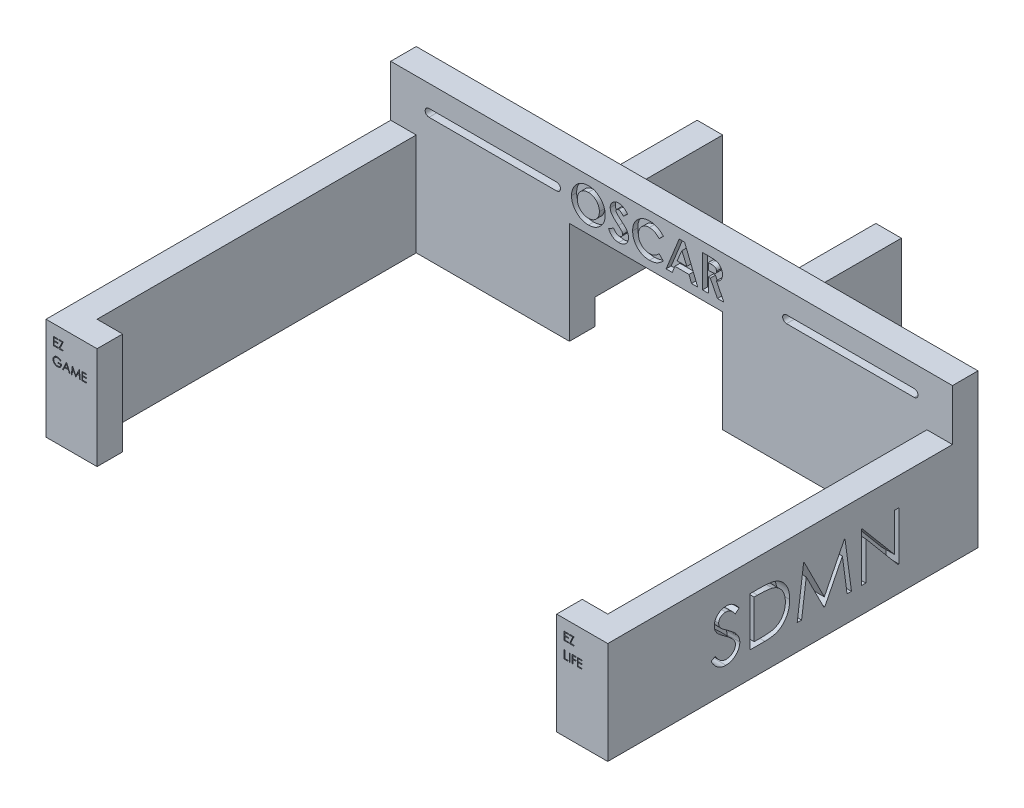
from build123d import *

# Parameters (mm, degrees)
SKETCH2_W           = 70
SKETCH2_H           = 40
BOSS_EXTRUDE1_DEPTH = 10
SKETCH3_W           = 10
SKETCH3_H           = 40
BOSS_EXTRUDE2_DEPTH = 135
SKETCH4_W           = 10
SKETCH4_H           = 40
BOSS_EXTRUDE3_DEPTH = 10
SKETCH5_W           = 10
SKETCH5_H           = 30
BOSS_EXTRUDE4_DEPTH = 50
SKETCH6_W           = 2
SKETCH6_H           = 23
SKETCH6_H_2         = 2
SKETCH6_W_2         = 13
SKETCH6_R           = 12.5
SKETCH6_R_2         = 10.5
CUT_EXTRUDE1_DEPTH  = 5
CUT_EXTRUDE2_DEPTH  = 2
CUT_EXTRUDE3_DEPTH  = 5
SKETCH10_W          = 0.284935898
SKETCH10_H          = 3.175
CUT_EXTRUDE4_DEPTH  = 1


with BuildPart() as part:
    # Sketch2 → Boss-Extrude1 (new body)
    # profile 1 of 3: a face of its own
    with BuildSketch(Plane.XY):
        Polygon((-110, 36.756781578), (-110, 16.756781578), (-40, 16.756781578), (20, 16.756781578), (40, 16.756781578), (110, 16.756781578), (110, 36.756781578), align=None)
        with BuildLine():
            Line((-45, 25.256781578), (-95, 25.256781578))
            ThreePointArc((-95, 25.256781578), (-96.5, 26.756781578), (-95, 28.256781578))
            Line((-95, 28.256781578), (-45, 28.256781578))
            ThreePointArc((-45, 28.256781578), (-43.939339828, 27.81744175), (-43.5, 26.756781578))
            ThreePointArc((-43.5, 26.756781578), (-43.939339828, 25.696121407), (-45, 25.256781578))
        make_face(mode=Mode.SUBTRACT)
        with BuildLine():
            ThreePointArc((45, 25.256781578), (43.5, 26.756781578), (45, 28.256781578))
            Line((45, 28.256781578), (95, 28.256781578))
            ThreePointArc((95, 28.256781578), (96.060660172, 27.81744175), (96.5, 26.756781578))
            ThreePointArc((96.5, 26.756781578), (96.060660172, 25.696121407), (95, 25.256781578))
            Line((95, 25.256781578), (45, 25.256781578))
        make_face(mode=Mode.SUBTRACT)
    # profile 2 of 3: a face of its own
    with BuildSketch(Plane.XY):
        with Locations((-75, -3.243218422)):
            Rectangle(SKETCH2_W, SKETCH2_H)
    # profile 3 of 3: a face of its own
    with BuildSketch(Plane.XY):
        Polygon((40, 16.756781578), (20, 16.756781578), (20, -23.243218422), (110, -23.243218422), (110, 16.756781578), align=None)
    extrude(amount=BOSS_EXTRUDE1_DEPTH)

    # Sketch3 → Boss-Extrude2 (add)
    with BuildSketch(Plane.XY.offset(10)):
        with Locations((-105, -3.243218422)):
            Rectangle(SKETCH3_W, SKETCH3_H)
        with Locations((105, -3.243218422)):
            Rectangle(SKETCH3_W, SKETCH3_H)
    extrude(amount=BOSS_EXTRUDE2_DEPTH)

    # Sketch4 → Boss-Extrude3 (add)
    with BuildSketch(Plane(origin=(-100, 0, 0), x_dir=(0, 0, -1), z_dir=(1, 0, 0))):
        with Locations((-140, -3.243218422)):
            Rectangle(SKETCH4_W, SKETCH4_H)
    boss_extrude3 = extrude(amount=BOSS_EXTRUDE3_DEPTH)

    # Mirror1: Boss-Extrude3 across plane
    add(boss_extrude3.mirror(Plane(origin=(0, 0, 0), x_dir=(0, 0, 1), z_dir=(1, 0, 0))))

    # Sketch5 → Boss-Extrude4 (add)
    with BuildSketch(Plane(origin=(0, 0, 0), x_dir=(-1, 0, 0), z_dir=(0, 0, -1))):
        with Locations((-25, 1.756781578)):
            Rectangle(SKETCH5_W, SKETCH5_H)
        with Locations((45, 1.756781578)):
            Rectangle(SKETCH5_W, SKETCH5_H)
    extrude(amount=BOSS_EXTRUDE4_DEPTH)

    # Sketch6 → Cut-Extrude1 (cut)
    # profile 1 of 7: a face of its own
    with BuildSketch(Plane.ZY.offset(110)):
        Polygon((28.898499969, 9.256781578), (28.898499969, -15.743218422), (30.898499969, -15.743218422), (30.898499969, 6.256781578), (30.898499969, 9.256781578), align=None)
    # profile 2 of 7: a face of its own
    with BuildSketch(Plane.ZY.offset(110)):
        Polygon((30.898499969, 9.256781578), (30.898499969, 6.256781578), (45.898499969, -15.743218422), (45.898499969, -12.743218422), align=None)
    # profile 3 of 7: a face of its own
    with BuildSketch(Plane.ZY.offset(110)):
        Polygon((45.898499969, -12.743218422), (45.898499969, -15.743218422), (47.898499969, -15.743218422), (47.898499969, 9.256781578), (45.898499969, 9.256781578), align=None)
    # profile 4 of 7: a face of its own
    with BuildSketch(Plane.ZY.offset(110)):
        with Locations((93.898499969, -2.243218422)):
            Rectangle(SKETCH6_W, SKETCH6_H)
    # profile 5 of 7: a face of its own
    with BuildSketch(Plane.ZY.offset(110)):
        with Locations((93.898499969, -14.743218422)):
            Rectangle(SKETCH6_W, SKETCH6_H_2)
    # profile 6 of 7: a face of its own
    with BuildSketch(Plane.ZY.offset(110)):
        with Locations((101.398499969, -14.743218422)):
            Rectangle(SKETCH6_W_2, SKETCH6_H_2)
    # profile 7 of 7: a face of its own
    with BuildSketch(Plane.ZY.offset(110)):
        with Locations(Location((65.398499969, -3.243218422, 0), (0, 0, 270))):
            Circle(SKETCH6_R)
        with Locations(Location((65.398499969, -3.243218422, 0), (0, 0, 270))):
            Circle(SKETCH6_R_2, mode=Mode.SUBTRACT)
    extrude(amount=-CUT_EXTRUDE1_DEPTH, mode=Mode.SUBTRACT)

    # Sketch8 → Cut-Extrude2 (cut)
    # profile 1 of 5: a face of its own
    with BuildSketch(Plane.XY.offset(10)):
        with BuildLine():
            add(Edge.make_bspline(
                [(-32.566225962, 33.282422604), (-32.345420897, 33.276705565), (-31.909501688, 33.265418836), (-31.268421838, 33.171335142), (-30.650622868, 33.018039249), (-30.056384144, 32.804946871), (-29.487193572, 32.526286382), (-28.941043425, 32.189957991), (-28.419889989, 31.7896137), (-27.929073624, 31.334592882), (-27.475470783, 30.83977761), (-27.082423656, 30.307020999), (-26.747247486, 29.750127307), (-26.469452579, 29.167604322), (-26.257860052, 28.555417794), (-26.109376823, 27.916689065), (-26.013983705, 27.251599848), (-26.003012029, 26.798764743), (-25.997435897, 26.568620521)],
                knots=[0, 0, 0, 0, 1.014329547, 2.002516266, 2.970391464, 3.935626869, 4.897733899, 5.877609409, 6.878433252, 7.912639331, 8.949961323, 9.958554974, 10.949718813, 11.932905612, 12.9188844, 13.919928257, 14.942845884, 16, 16, 16, 16], degree=3))
            add(Edge.make_bspline(
                [(-25.997435897, 26.568620521), (-26.003374236, 26.341069492), (-26.015075922, 25.892672889), (-26.105482458, 25.23371273), (-26.256466163, 24.601826117), (-26.464469915, 23.995582759), (-26.737226673, 23.41791909), (-27.065866543, 22.86514681), (-27.459061707, 22.342395776), (-27.902470794, 21.849946517), (-28.390625717, 21.402943146), (-28.907659275, 21.009022198), (-29.451184125, 20.675228452), (-30.020404721, 20.401714802), (-30.616541729, 20.189450931), (-31.238122617, 20.039683346), (-31.885108923, 19.94866656), (-32.325090986, 19.937041308), (-32.548417468, 19.931140553)],
                knots=[0, 0, 0, 0, 1.051557043, 2.072126891, 3.067553643, 4.050577992, 5.02905126, 6.015227836, 7.017913613, 8.04756643, 9.074058332, 10.072836633, 11.047628519, 12.017157415, 12.98668631, 13.966869689, 14.968021931, 16, 16, 16, 16], degree=3))
            add(Edge.make_bspline(
                [(-32.548417468, 19.931140553), (-32.78199019, 19.936433821), (-33.240928663, 19.946834371), (-33.912587172, 20.045738848), (-34.55609406, 20.19472354), (-35.166043499, 20.417075201), (-35.748647301, 20.695033473), (-36.299624907, 21.037355751), (-36.81879115, 21.443476319), (-37.30316801, 21.90299428), (-37.742014617, 22.405807717), (-38.129382828, 22.936985523), (-38.456136507, 23.492469969), (-38.72228761, 24.072521032), (-38.932110448, 24.673533836), (-39.080116619, 25.299168722), (-39.167547397, 25.947925192), (-39.179725997, 26.388573555), (-39.185897436, 26.611869719)],
                knots=[0, 0, 0, 0, 1.067978421, 2.098431617, 3.099715153, 4.085208694, 5.062210972, 6.048429807, 7.046490867, 8.072918869, 9.098532598, 10.095778865, 11.076610158, 12.041847152, 13.011192615, 13.984257998, 14.978533688, 16, 16, 16, 16], degree=3))
            add(Edge.make_bspline(
                [(-39.185897436, 26.611869719), (-39.183960483, 26.762091689), (-39.180111103, 27.060633475), (-39.133741265, 27.503057161), (-39.066982031, 27.936845331), (-38.968248291, 28.360268466), (-38.848312033, 28.776313617), (-38.692917667, 29.181108134), (-38.516036826, 29.578976336), (-38.309368218, 29.965218901), (-38.079572708, 30.336282074), (-37.828845347, 30.690415486), (-37.556555686, 31.023337147), (-37.263580858, 31.337234879), (-36.948911233, 31.630045411), (-36.616685965, 31.905913883), (-36.260461818, 32.157512248), (-35.888035422, 32.39098504), (-35.501506429, 32.602110437), (-35.102448365, 32.78181406), (-34.699082613, 32.938746173), (-34.286020752, 33.062603936), (-33.867689473, 33.163484788), (-33.439619754, 33.230199027), (-33.005678962, 33.27656758), (-32.713057932, 33.280466298), (-32.566225962, 33.282422604)],
                knots=[0, 0, 0, 0, 1.034744296, 2.056386356, 3.06226378, 4.057406941, 5.050368692, 6.043467995, 7.042652155, 8.049140477, 9.059438543, 10.048523776, 11.036952808, 12.020949711, 13.004946614, 13.997082645, 14.994316842, 16.007702937, 17.024872941, 18.026463647, 19.021641123, 20.005082605, 20.995858141, 21.984425357, 22.988620895, 24, 24, 24, 24], degree=3))
        make_face()
        with BuildLine():
            add(Edge.make_bspline(
                [(-32.601842949, 31.002935424), (-32.750444728, 30.998948105), (-33.043725175, 30.991078732), (-33.47391418, 30.931124754), (-33.886910817, 30.835371437), (-34.280425683, 30.696673927), (-34.656164304, 30.520147198), (-35.01479275, 30.306408056), (-35.351344756, 30.048109458), (-35.670307921, 29.759118303), (-35.958438653, 29.437115742), (-36.213011245, 29.092035235), (-36.426047502, 28.724453062), (-36.604466701, 28.337783973), (-36.738776814, 27.927679978), (-36.834441881, 27.497353465), (-36.894898633, 27.046062961), (-36.902519281, 26.738418811), (-36.906410256, 26.581340873)],
                knots=[0, 0, 0, 0, 1.033739768, 2.040188636, 3.016340934, 3.979330865, 4.937572243, 5.900995986, 6.878200029, 7.884839167, 8.891893314, 9.879764717, 10.863503415, 11.843163062, 12.837761627, 13.859916423, 14.907309254, 16, 16, 16, 16], degree=3))
            add(Edge.make_bspline(
                [(-36.906410256, 26.581340873), (-36.901251417, 26.407263184), (-36.891140947, 26.066099756), (-36.820002451, 25.568419739), (-36.698291566, 25.098410358), (-36.522543413, 24.658370358), (-36.304569596, 24.243413424), (-36.03388071, 23.858625445), (-35.714860634, 23.501702488), (-35.469090151, 23.293315999), (-35.344350962, 23.187550809)],
                knots=[0, 0, 0, 0, 1.078454662, 2.113592447, 3.107694534, 4.079536787, 5.043276885, 6.005368276, 6.987637804, 8, 8, 8, 8], degree=3))
            add(Edge.make_bspline(
                [(-35.344350962, 23.187550809), (-35.242165751, 23.109415549), (-35.04009758, 22.954905429), (-34.717552785, 22.756869013), (-34.385395158, 22.58713205), (-34.041118154, 22.449986591), (-33.685448868, 22.342110279), (-33.318436072, 22.266566271), (-32.940599794, 22.219155873), (-32.685089195, 22.213489432), (-32.556049679, 22.210627732)],
                knots=[0, 0, 0, 0, 1.023928204, 2.024787132, 3.009472467, 3.9914905, 4.972207045, 5.96565515, 6.972602802, 8, 8, 8, 8], degree=3))
            add(Edge.make_bspline(
                [(-32.556049679, 22.210627732), (-32.410003111, 22.21464886), (-32.122651896, 22.222560554), (-31.700471091, 22.281776466), (-31.296009058, 22.381991168), (-30.906754861, 22.519471974), (-30.533830936, 22.698215149), (-30.179059864, 22.918583808), (-29.841819634, 23.177872109), (-29.523262824, 23.470658351), (-29.232086842, 23.79392938), (-28.97804549, 24.14085051), (-28.758235746, 24.503778031), (-28.583526777, 24.887848632), (-28.443910374, 25.289436866), (-28.349396686, 25.71032128), (-28.288429212, 26.14876683), (-28.280806416, 26.447144521), (-28.276923077, 26.599149367)],
                knots=[0, 0, 0, 0, 1.026359118, 2.019393844, 2.989460624, 3.950973911, 4.916101784, 5.890408035, 6.881132271, 7.902007068, 8.92769091, 9.933912415, 10.920395702, 11.90457117, 12.894218921, 13.903490204, 14.931958862, 16, 16, 16, 16], degree=3))
            add(Edge.make_bspline(
                [(-28.276923077, 26.599149367), (-28.280940781, 26.750280143), (-28.288849017, 27.047758027), (-28.348169153, 27.485076336), (-28.447748319, 27.904102669), (-28.585641966, 28.30552134), (-28.761724851, 28.689725889), (-28.979469201, 29.055365225), (-29.238110979, 29.402085864), (-29.53169756, 29.727525038), (-29.85124851, 30.026582792), (-30.194318383, 30.28611056), (-30.5513077, 30.511631938), (-30.930407537, 30.68829628), (-31.32386183, 30.829044386), (-31.734071457, 30.932693311), (-32.162590112, 30.990657553), (-32.454120214, 30.99880632), (-32.601842949, 31.002935424)],
                knots=[0, 0, 0, 0, 1.055025985, 2.07665775, 3.074803781, 4.057872707, 5.035505728, 6.020516407, 7.023567878, 8.050795229, 9.077271434, 10.074415901, 11.050397877, 12.019801805, 12.988065821, 13.964604439, 14.968634123, 16, 16, 16, 16], degree=3))
        make_face(mode=Mode.SUBTRACT)
    # profile 2 of 5: a face of its own
    with BuildSketch(Plane.XY.offset(10)):
        with BuildLine():
            Line((-17.205128205, 31.259886546), (-18.909655449, 29.700371322))
            add(Edge.make_bspline(
                [(-18.909655449, 29.700371322), (-18.982670087, 29.80336606), (-19.12284801, 30.001101594), (-19.350061803, 30.265874134), (-19.576249609, 30.491744815), (-19.80350692, 30.677770053), (-20.03384806, 30.822819607), (-20.266873189, 30.925516294), (-20.501261223, 30.990801552), (-20.6587338, 30.998931137), (-20.736298077, 31.002935424)],
                knots=[0, 0, 0, 0, 1.299362458, 2.494594718, 3.587462134, 4.587049575, 5.512617175, 6.380583204, 7.202344345, 8, 8, 8, 8], degree=3))
            add(Edge.make_bspline(
                [(-20.736298077, 31.002935424), (-20.808647809, 31.000398124), (-20.948336134, 30.995499265), (-21.147472203, 30.946804965), (-21.324268042, 30.862765755), (-21.478551105, 30.752877417), (-21.600766053, 30.620487446), (-21.698345212, 30.481644407), (-21.753290477, 30.328393092), (-21.760522355, 30.223133907), (-21.764102564, 30.171024367)],
                knots=[0, 0, 0, 0, 1.185010067, 2.2879431, 3.333075148, 4.379039566, 5.372662701, 6.27520591, 7.14612461, 8, 8, 8, 8], degree=3))
            add(Edge.make_bspline(
                [(-21.764102564, 30.171024367), (-21.761859029, 30.118163383), (-21.757340861, 30.011708709), (-21.713701506, 29.855686126), (-21.647924537, 29.703233899), (-21.585071959, 29.610428975), (-21.552944712, 29.562991514)],
                knots=[0, 0, 0, 0, 0.967525499, 1.948461899, 2.951351359, 4, 4, 4, 4], degree=3))
            add(Edge.make_bspline(
                [(-21.552944712, 29.562991514), (-21.523737569, 29.526118872), (-21.456506583, 29.441242921), (-21.328310863, 29.306812644), (-21.167323962, 29.142123787), (-20.967350765, 28.952839519), (-20.73669271, 28.732152436), (-20.464658497, 28.488737832), (-20.159078458, 28.215057439), (-19.941879246, 28.024476323), (-19.828064904, 27.924610104)],
                knots=[0, 0, 0, 0, 0.473873513, 1.090794244, 1.870441696, 2.795289791, 3.865433203, 5.087734844, 6.473946851, 8, 8, 8, 8], degree=3))
            add(Edge.make_bspline(
                [(-19.828064904, 27.924610104), (-19.721233772, 27.832153148), (-19.518490479, 27.656689054), (-19.230027034, 27.407645946), (-18.976515709, 27.183587934), (-18.754263423, 26.987877649), (-18.566639303, 26.818461643), (-18.412854576, 26.674530109), (-18.291031024, 26.55888513), (-18.221781468, 26.489035491), (-18.192227564, 26.459225489)],
                knots=[0, 0, 0, 0, 1.543621617, 2.929473131, 4.163658386, 5.240097082, 6.164993805, 6.925417477, 7.541396219, 8, 8, 8, 8], degree=3))
            add(Edge.make_bspline(
                [(-18.192227564, 26.459225489), (-18.080106215, 26.337886176), (-17.864569606, 26.104629404), (-17.584447996, 25.743154765), (-17.35389885, 25.390281812), (-17.175541659, 25.039370666), (-17.040839135, 24.68535838), (-16.945872071, 24.31956282), (-16.888995664, 23.938161652), (-16.882681055, 23.677901915), (-16.879487179, 23.546264751)],
                knots=[0, 0, 0, 0, 1.206664779, 2.319633467, 3.337109185, 4.282041471, 5.190008762, 6.099243693, 7.03861361, 8, 8, 8, 8], degree=3))
            add(Edge.make_bspline(
                [(-16.879487179, 23.546264751), (-16.881760498, 23.418000479), (-16.886220835, 23.166341204), (-16.9408514, 22.79807534), (-17.01875138, 22.445628926), (-17.139198415, 22.112837076), (-17.285998548, 21.794237113), (-17.470033717, 21.494791813), (-17.686157788, 21.211470666), (-17.933869157, 20.949338384), (-18.207867346, 20.711471507), (-18.501756444, 20.499716795), (-18.818410247, 20.324886307), (-19.155123314, 20.180925871), (-19.51171541, 20.070045619), (-19.887761728, 19.988094778), (-20.283837454, 19.938909175), (-20.554679743, 19.933767404), (-20.693048878, 19.931140553)],
                knots=[0, 0, 0, 0, 1.043214005, 2.046824704, 3.02475056, 3.976699089, 4.921714032, 5.875962561, 6.831408892, 7.817874052, 8.806269674, 9.781291748, 10.760897367, 11.74438705, 12.757449933, 13.795994037, 14.874007457, 16, 16, 16, 16], degree=3))
            add(Edge.make_bspline(
                [(-20.693048878, 19.931140553), (-20.801667471, 19.933067519), (-21.016794577, 19.936884017), (-21.333859407, 19.968042548), (-21.640021344, 20.018329102), (-21.934935521, 20.090404755), (-22.219930581, 20.181734383), (-22.495018227, 20.293290026), (-22.758299438, 20.426800753), (-23.011766324, 20.579521053), (-23.254186724, 20.756849439), (-23.488625948, 20.955160489), (-23.712755323, 21.177504316), (-23.927651297, 21.423355086), (-24.131938906, 21.693408988), (-24.332305216, 21.983905024), (-24.519845346, 22.300234403), (-24.635697226, 22.522142022), (-24.694871795, 22.635487508)],
                knots=[0, 0, 0, 0, 1.016823716, 2.013894106, 2.979844003, 3.91962641, 4.853723003, 5.779685073, 6.695824784, 7.614987388, 8.547259901, 9.504950863, 10.487499108, 11.500346958, 12.559593716, 13.656357062, 14.802919212, 16, 16, 16, 16], degree=3))
            Line((-24.694871795, 22.635487508), (-22.690144231, 23.83883286))
            add(Edge.make_bspline(
                [(-22.690144231, 23.83883286), (-22.616125689, 23.710170925), (-22.474225819, 23.463514997), (-22.233763224, 23.132101498), (-21.987421571, 22.848300694), (-21.729505662, 22.617128785), (-21.463151658, 22.435494703), (-21.187073007, 22.305686387), (-20.901075742, 22.225335186), (-20.706267398, 22.215522449), (-20.609094551, 22.210627732)],
                knots=[0, 0, 0, 0, 1.283663364, 2.460892379, 3.537111102, 4.529833553, 5.449777664, 6.316464042, 7.160231139, 8, 8, 8, 8], degree=3))
            add(Edge.make_bspline(
                [(-20.609094551, 22.210627732), (-20.510255854, 22.214625023), (-20.318494388, 22.22238035), (-20.044779432, 22.294013964), (-19.793827197, 22.406483992), (-19.576905939, 22.566963214), (-19.393230694, 22.752180627), (-19.25766782, 22.958243468), (-19.172506309, 23.181198488), (-19.163502672, 23.336077711), (-19.158974359, 23.413973085)],
                knots=[0, 0, 0, 0, 1.13588714, 2.203786484, 3.234766741, 4.283437687, 5.291419208, 6.222934724, 7.106237994, 8, 8, 8, 8], degree=3))
            add(Edge.make_bspline(
                [(-19.158974359, 23.413973085), (-19.163156071, 23.486442054), (-19.171650818, 23.633655829), (-19.23422051, 23.852539039), (-19.332036023, 24.071322705), (-19.447758672, 24.250774987), (-19.565520959, 24.401025519), (-19.678128266, 24.531210808), (-19.815254177, 24.67504276), (-19.976551003, 24.832702307), (-20.15988759, 25.005577364), (-20.365418377, 25.193651004), (-20.595496908, 25.395266521), (-20.758116867, 25.53260502), (-20.843149038, 25.604417796)],
                knots=[0, 0, 0, 0, 0.916159276, 1.861089862, 2.860218735, 3.940849679, 4.552606315, 5.27541173, 6.11797699, 7.06649574, 8.129236253, 9.306560635, 10.591630461, 12, 12, 12, 12], degree=3))
            add(Edge.make_bspline(
                [(-20.843149038, 25.604417796), (-21.004798581, 25.74118881), (-21.315052979, 26.003693782), (-21.753481808, 26.391405363), (-22.148545438, 26.753757361), (-22.496831678, 27.095229238), (-22.802778231, 27.409514802), (-23.064313095, 27.699166798), (-23.278563191, 27.966419497), (-23.504015219, 28.282962435), (-23.718239722, 28.668691755), (-23.903390484, 29.132768843), (-24.023508484, 29.596787046), (-24.036966035, 29.90830331), (-24.043589744, 30.061629335)],
                knots=[0, 0, 0, 0, 1.345494975, 2.582412109, 3.71882943, 4.751509156, 5.681369928, 6.505683931, 7.230279997, 7.856715994, 8.973648664, 10.023341002, 11.027102913, 12, 12, 12, 12], degree=3))
            add(Edge.make_bspline(
                [(-24.043589744, 30.061629335), (-24.040834952, 30.170359922), (-24.035407717, 30.384570858), (-23.986995944, 30.699536827), (-23.914642704, 31.003452524), (-23.809565028, 31.295209124), (-23.673186892, 31.574441191), (-23.507560943, 31.842515683), (-23.310115324, 32.096965303), (-23.087607441, 32.337621369), (-22.842460722, 32.557553627), (-22.5804903, 32.751665882), (-22.303178949, 32.915615915), (-22.012223121, 33.051624373), (-21.705819882, 33.155730207), (-21.386226493, 33.229525611), (-21.052984554, 33.273416764), (-20.82632058, 33.279383257), (-20.710857372, 33.282422604)],
                knots=[0, 0, 0, 0, 1.010766082, 1.991317756, 2.957454644, 3.913069143, 4.869106762, 5.843196583, 6.838735724, 7.860187025, 8.887984031, 9.89767229, 10.887916223, 11.879572884, 12.879850636, 13.892031539, 14.926195476, 16, 16, 16, 16], degree=3))
            add(Edge.make_bspline(
                [(-20.710857372, 33.282422604), (-20.561222769, 33.276948651), (-20.263134727, 33.266043956), (-19.822402959, 33.180772799), (-19.391914596, 33.046674923), (-19.045019004, 32.884900589), (-18.769000657, 32.728189715), (-18.557458378, 32.583910082), (-18.342202722, 32.418630009), (-18.121497787, 32.231828653), (-17.899444611, 32.019986433), (-17.669729161, 31.788146418), (-17.435481591, 31.534304969), (-17.283257812, 31.352961815), (-17.205128205, 31.259886546)],
                knots=[0, 0, 0, 0, 1.282922637, 2.555718331, 3.837320111, 5.142675274, 5.830281639, 6.55870424, 7.337177975, 8.157850921, 9.037902056, 9.96903443, 10.957596896, 12, 12, 12, 12], degree=3))
        make_face()
    # profile 3 of 5: a face of its own
    with BuildSketch(Plane.XY.offset(10)):
        with BuildLine():
            Line((-3.202564103, 30.753616514), (-4.874018429, 29.155940232))
            add(Edge.make_bspline(
                [(-4.874018429, 29.155940232), (-5.015804803, 29.302547579), (-5.292758009, 29.588917659), (-5.73903385, 29.968046408), (-6.203144476, 30.283998923), (-6.67606154, 30.550092118), (-7.16629145, 30.751410586), (-7.668165813, 30.898114744), (-8.184889244, 30.987554724), (-8.534587788, 30.99778824), (-8.710476763, 31.002935424)],
                knots=[0, 0, 0, 0, 1.115251505, 2.178435587, 3.19620269, 4.182487026, 5.141301733, 6.088180966, 7.038406374, 8, 8, 8, 8], degree=3))
            add(Edge.make_bspline(
                [(-8.710476763, 31.002935424), (-8.857365432, 30.998868969), (-9.147234036, 30.990844268), (-9.572837107, 30.932015291), (-9.97994844, 30.831974055), (-10.369961642, 30.694098702), (-10.741729082, 30.515695312), (-11.096030216, 30.296901965), (-11.431991531, 30.039694677), (-11.745175171, 29.745404249), (-12.031664558, 29.423869842), (-12.284796173, 29.080793397), (-12.496834506, 28.716960883), (-12.670850917, 28.336056927), (-12.806402974, 27.936318519), (-12.903204173, 27.518014777), (-12.9591914, 27.080647534), (-12.967547869, 26.783328542), (-12.971794872, 26.632222283)],
                knots=[0, 0, 0, 0, 1.035432265, 2.043311493, 3.022114605, 3.98653278, 4.95457646, 5.923598177, 6.917315552, 7.932509744, 8.948865224, 9.949768934, 10.933144597, 11.912367597, 12.897413939, 13.903909035, 14.934704909, 16, 16, 16, 16], degree=3))
            add(Edge.make_bspline(
                [(-12.971794872, 26.632222283), (-12.970570934, 26.526165339), (-12.968158527, 26.317124921), (-12.941750469, 26.007896127), (-12.899227268, 25.707871092), (-12.837685661, 25.417504273), (-12.760727277, 25.136544037), (-12.670437569, 24.862566552), (-12.557170458, 24.599357573), (-12.431442256, 24.343860096), (-12.285221806, 24.103045691), (-12.127569187, 23.87340917), (-11.956620661, 23.656076188), (-11.771268985, 23.451935209), (-11.568905564, 23.2641765), (-11.354760743, 23.087153933), (-11.125222197, 22.925298982), (-10.885058022, 22.774549719), (-10.632193504, 22.643592552), (-10.373489443, 22.524970658), (-10.105023364, 22.428632044), (-9.830064003, 22.350974332), (-9.549593967, 22.284938046), (-9.26087, 22.244277476), (-8.966394977, 22.213485701), (-8.767379288, 22.211584489), (-8.667227564, 22.210627732)],
                knots=[0, 0, 0, 0, 1.103660481, 2.175337485, 3.227646561, 4.255952547, 5.262355991, 6.258840057, 7.255597736, 8.242457506, 9.22035537, 10.185017736, 11.140346927, 12.096287581, 13.051739095, 14.01125915, 14.986044842, 15.97314143, 16.960198552, 17.947847494, 18.933482797, 19.925264591, 20.920966487, 21.929612487, 22.958107872, 24, 24, 24, 24], degree=3))
            add(Edge.make_bspline(
                [(-8.667227564, 22.210627732), (-8.497353028, 22.215541405), (-8.16359374, 22.225195495), (-7.673753993, 22.30068911), (-7.206985515, 22.424871835), (-6.834039734, 22.571524417), (-6.541846566, 22.716345746), (-6.319404227, 22.850298344), (-6.089381511, 23.000139031), (-5.855598899, 23.171522958), (-5.6154268, 23.36239345), (-5.373104806, 23.576930925), (-5.12242943, 23.808070972), (-4.958214477, 23.973040165), (-4.874018429, 24.057622924)],
                knots=[0, 0, 0, 0, 1.404581149, 2.759636711, 4.088442092, 5.392261763, 6.066678138, 6.783632037, 7.538459478, 8.336747902, 9.180226004, 10.074962426, 11.012997595, 12, 12, 12, 12], degree=3))
            Line((-4.874018429, 24.057622924), (-3.253445513, 22.355639751))
            add(Edge.make_bspline(
                [(-3.253445513, 22.355639751), (-3.367363066, 22.24565593), (-3.589705768, 22.030991032), (-3.925103561, 21.726186908), (-4.260079243, 21.452286518), (-4.586540498, 21.19934848), (-4.909835104, 20.974741493), (-5.229928775, 20.778241238), (-5.54319791, 20.60487794), (-5.856147644, 20.457575287), (-6.170725311, 20.332500035), (-6.494388763, 20.224818453), (-6.828127469, 20.133723709), (-7.173979752, 20.060222213), (-7.528719715, 20.001283937), (-7.89566725, 19.961500941), (-8.27249573, 19.934756157), (-8.528104326, 19.932352916), (-8.657051282, 19.931140553)],
                knots=[0, 0, 0, 0, 1.244526981, 2.429050516, 3.560637417, 4.644440555, 5.67424972, 6.652764056, 7.595344123, 8.486817594, 9.369275933, 10.254498637, 11.166417451, 12.086725134, 13.032340136, 13.991389299, 14.986715468, 16, 16, 16, 16], degree=3))
            add(Edge.make_bspline(
                [(-8.657051282, 19.931140553), (-8.893910868, 19.937178576), (-9.35737924, 19.948993309), (-10.036580054, 20.036532482), (-10.681802595, 20.183290363), (-11.294616569, 20.390846486), (-11.874827115, 20.655989705), (-12.422285798, 20.981042842), (-12.936110236, 21.365142282), (-13.41214974, 21.803786006), (-13.842750126, 22.288231175), (-14.223351002, 22.808392384), (-14.53818406, 23.366826034), (-14.799596733, 23.955282277), (-15.004018004, 24.576446467), (-15.147895925, 25.230990514), (-15.236624388, 25.918282416), (-15.246331408, 26.387718629), (-15.251282051, 26.627134142)],
                knots=[0, 0, 0, 0, 1.078019885, 2.10938526, 3.111377082, 4.085535484, 5.04941344, 6.010039228, 6.978205633, 7.964457913, 8.951525778, 9.924444315, 10.892603023, 11.863865945, 12.85144698, 13.863884204, 14.910567087, 16, 16, 16, 16], degree=3))
            add(Edge.make_bspline(
                [(-15.251282051, 26.627134142), (-15.249190149, 26.783278898), (-15.245044511, 27.09271964), (-15.20147347, 27.548550923), (-15.140732904, 27.992904888), (-15.04437352, 28.421167669), (-14.928221786, 28.839108755), (-14.783771845, 29.242185614), (-14.611254402, 29.631556731), (-14.416230102, 30.007873935), (-14.195601062, 30.368671946), (-13.949134204, 30.71085094), (-13.683174546, 31.037052476), (-13.39133151, 31.342948886), (-13.077845958, 31.631225998), (-12.74130254, 31.900321585), (-12.383725394, 32.15409478), (-12.004146694, 32.386001389), (-11.609940641, 32.595773244), (-11.206079212, 32.780800978), (-10.793554647, 32.935441556), (-10.374111138, 33.06371021), (-9.94597654, 33.159453691), (-9.51220677, 33.231928417), (-9.069110968, 33.272442253), (-8.771610524, 33.279074626), (-8.621434295, 33.282422604)],
                knots=[0, 0, 0, 0, 1.071919942, 2.124283339, 3.142214191, 4.149696895, 5.136002878, 6.119640489, 7.086990633, 8.058538607, 9.028339693, 9.988281803, 10.952401235, 11.916291999, 12.888973767, 13.874849856, 14.873389453, 15.898127285, 16.927174885, 17.938320013, 18.946391617, 19.950418109, 20.947802303, 21.956882652, 22.968648068, 24, 24, 24, 24], degree=3))
            add(Edge.make_bspline(
                [(-8.621434295, 33.282422604), (-8.493318574, 33.28050346), (-8.238419178, 33.276685125), (-7.858831204, 33.244855149), (-7.482278997, 33.194866495), (-7.110110729, 33.119444261), (-6.739664273, 33.029908538), (-6.37580771, 32.912673859), (-6.012801005, 32.781993716), (-5.656337381, 32.625792289), (-5.305919266, 32.455284322), (-4.969755756, 32.261836841), (-4.642202697, 32.057354388), (-4.330518468, 31.829734796), (-4.028864553, 31.587234251), (-3.738818326, 31.32872135), (-3.462925112, 31.049885927), (-3.28978985, 30.85287224), (-3.202564103, 30.753616514)],
                knots=[0, 0, 0, 0, 0.996412454, 1.982464992, 2.961075852, 3.949442424, 4.934965278, 5.923860011, 6.921385422, 7.934793307, 8.949617135, 9.951082467, 10.950285876, 11.951772932, 12.951063433, 13.960125323, 14.972308753, 16, 16, 16, 16], degree=3))
        make_face()
    # profile 4 of 5: a face of its own
    with BuildSketch(Plane.XY.offset(10)):
        Polygon((2.987159455, 32.956781578), (5.101282051, 32.956781578), (10.230128205, 20.256781578), (7.795452724, 20.256781578), (6.808353365, 22.861909783), (1.275, 22.861909783), (0.287900641, 20.256781578), (-2.144230769, 20.256781578), align=None)
        Polygon((4.042948718, 29.550271162), (2.139983974, 25.141396963), (5.945913462, 25.141396963), align=None, mode=Mode.SUBTRACT)
    # profile 5 of 5: a face of its own
    with BuildSketch(Plane.XY.offset(10)):
        with BuildLine():
            Line((12.102564103, 32.956781578), (14.758573718, 32.956781578))
            add(Edge.make_bspline(
                [(14.758573718, 32.956781578), (14.934135145, 32.956158436), (15.271789222, 32.954959958), (15.75866796, 32.936051147), (16.205933036, 32.909737984), (16.614246669, 32.869583399), (16.983434175, 32.816343273), (17.313865566, 32.753581975), (17.605531183, 32.68205202), (17.860890824, 32.592920053), (18.091340273, 32.492380545), (18.306151197, 32.376858807), (18.510062646, 32.24764121), (18.701711692, 32.101327689), (18.88276381, 31.940550388), (19.053560566, 31.765147469), (19.211688443, 31.573631588), (19.356168307, 31.367212882), (19.487850073, 31.150065137), (19.604229135, 30.921890207), (19.698868783, 30.682529413), (19.782493056, 30.435442034), (19.842724911, 30.177095909), (19.884615285, 29.91000608), (19.915285778, 29.633232364), (19.917049185, 29.445204589), (19.917948718, 29.349289591)],
                knots=[0, 0, 0, 0, 1.749336639, 3.364467119, 4.854658419, 6.213483162, 7.451590619, 8.570285859, 9.5643256, 10.440900261, 11.26203566, 12.067320669, 12.869050712, 13.665104639, 14.467235401, 15.27997916, 16.102287765, 16.939272006, 17.78853747, 18.631303466, 19.488103222, 20.351255419, 21.228522269, 22.127379805, 23.044756219, 24, 24, 24, 24], degree=3))
            add(Edge.make_bspline(
                [(19.917948718, 29.349289591), (19.915612055, 29.249176367), (19.911030285, 29.052872581), (19.886350381, 28.76451833), (19.841243268, 28.488641153), (19.772921983, 28.226048783), (19.69439554, 27.973472952), (19.589975514, 27.735573842), (19.472127194, 27.508891557), (19.332162188, 27.296632601), (19.178557432, 27.094082281), (18.999918331, 26.909001049), (18.807817956, 26.731441492), (18.591457645, 26.572525336), (18.360374761, 26.421507246), (18.109977931, 26.284644639), (17.84190133, 26.158497104), (17.653430204, 26.088148524), (17.557051282, 26.052174206)],
                knots=[0, 0, 0, 0, 1.099860209, 2.156625411, 3.176576793, 4.16617041, 5.135385252, 6.078461593, 7.016046972, 7.938469504, 8.868247731, 9.803980173, 10.76021508, 11.73834243, 12.748633912, 13.790971185, 14.870363756, 16, 16, 16, 16], degree=3))
            Line((17.557051282, 26.052174206), (20.487820513, 20.256781578))
            Line((20.487820513, 20.256781578), (17.953926282, 20.256781578))
            Line((17.953926282, 20.256781578), (15.155448718, 25.792679014))
            Line((15.155448718, 25.792679014), (14.382051282, 25.792679014))
            Line((14.382051282, 25.792679014), (14.382051282, 20.256781578))
            Line((14.382051282, 20.256781578), (12.102564103, 20.256781578))
            Line((12.102564103, 20.256781578), (12.102564103, 32.956781578))
        make_face()
        with BuildLine():
            Line((14.382051282, 28.072166194), (15.269931891, 28.072166194))
            add(Edge.make_bspline(
                [(15.269931891, 28.072166194), (15.378482676, 28.073388766), (15.586334105, 28.075729728), (15.885251758, 28.086588082), (16.156740276, 28.112751351), (16.401965521, 28.145807663), (16.622161444, 28.183975949), (16.815363976, 28.23867342), (16.984550072, 28.297283145), (17.127714871, 28.370119829), (17.250031586, 28.452950937), (17.355644241, 28.547049135), (17.443001049, 28.655955817), (17.514900158, 28.77671137), (17.570829848, 28.910383846), (17.611654237, 29.055505825), (17.634469033, 29.213730433), (17.637093953, 29.322926957), (17.638461538, 29.379818437)],
                knots=[0, 0, 0, 0, 1.688639943, 3.233382647, 4.650958383, 5.928841754, 7.082724185, 8.122798841, 9.049171256, 9.863274652, 10.613301712, 11.341792392, 12.054588806, 12.776240173, 13.521029143, 14.301969904, 15.115324896, 16, 16, 16, 16], degree=3))
            add(Edge.make_bspline(
                [(17.638461538, 29.379818437), (17.635875993, 29.447125212), (17.630797167, 29.579336898), (17.58039944, 29.769675367), (17.500177144, 29.945846643), (17.390214349, 30.10705474), (17.251730505, 30.248380886), (17.092809368, 30.37296101), (16.910021036, 30.47146965), (16.740772795, 30.5364449), (16.586796457, 30.575320262), (16.447837669, 30.604289839), (16.286922557, 30.624821409), (16.103929637, 30.646598794), (15.899325365, 30.660720326), (15.671994526, 30.671026229), (15.422590011, 30.67524288), (15.248731377, 30.67659087), (15.157992788, 30.677294399)],
                knots=[0, 0, 0, 0, 1.020303359, 2.004196876, 2.966617323, 3.9489082, 4.950758222, 5.960522915, 7.003732012, 8.091992268, 8.70421221, 9.413913587, 10.24622431, 11.166358409, 12.212345909, 13.359657661, 14.621978493, 16, 16, 16, 16], degree=3))
            Line((15.157992788, 30.677294399), (14.382051282, 30.677294399))
            Line((14.382051282, 30.677294399), (14.382051282, 28.072166194))
        make_face(mode=Mode.SUBTRACT)
    extrude(amount=-CUT_EXTRUDE2_DEPTH, mode=Mode.SUBTRACT)

    # Sketch9 → Cut-Extrude3 (cut)
    # profile 1 of 4: a face of its own
    with BuildSketch(Plane(origin=(110, 0, 0), x_dir=(0, 0, -1), z_dir=(1, 0, 0))):
        with BuildLine():
            Line((-104.511538462, -9.568308566), (-102.901141827, -8.602833806))
            add(Edge.make_bspline(
                [(-102.901141827, -8.602833806), (-102.751363993, -8.853555673), (-102.464395442, -9.333929094), (-101.985688759, -9.983033571), (-101.489665343, -10.53473331), (-100.97265197, -10.985818845), (-100.437804452, -11.340959215), (-99.881631246, -11.592431362), (-99.30600659, -11.749272599), (-98.914263362, -11.76832307), (-98.718689904, -11.777833806)],
                knots=[0, 0, 0, 0, 1.272034388, 2.437168799, 3.508375237, 4.49857839, 5.41946034, 6.295179144, 7.148887113, 8, 8, 8, 8], degree=3))
            add(Edge.make_bspline(
                [(-98.718689904, -11.777833806), (-98.551665706, -11.773181946), (-98.220539841, -11.763959622), (-97.733065347, -11.675345542), (-97.259635824, -11.539208098), (-96.81000881, -11.344239885), (-96.390388393, -11.108354698), (-96.022414809, -10.823441932), (-95.704300964, -10.504456727), (-95.444082784, -10.148588278), (-95.244438591, -9.765862083), (-95.09099319, -9.373018691), (-95.00583929, -8.963886912), (-94.993011817, -8.688421393), (-94.986538462, -8.549408326)],
                knots=[0, 0, 0, 0, 1.095163259, 2.171163733, 3.241058638, 4.321873601, 5.38011039, 6.391990106, 7.366004449, 8.327778327, 9.272591725, 10.192022065, 11.087607919, 12, 12, 12, 12], degree=3))
            add(Edge.make_bspline(
                [(-94.986538462, -8.549408326), (-94.994562924, -8.390798844), (-95.010875484, -8.068368944), (-95.148751111, -7.592665119), (-95.365644869, -7.121898416), (-95.565738687, -6.830698671), (-95.669621394, -6.679516499)],
                knots=[0, 0, 0, 0, 0.938893495, 1.908633276, 2.914225137, 4, 4, 4, 4], degree=3))
            add(Edge.make_bspline(
                [(-95.669621394, -6.679516499), (-95.754914309, -6.570404502), (-95.933976113, -6.341337512), (-96.241810575, -6.000368445), (-96.603031854, -5.648659622), (-97.005278346, -5.27278104), (-97.463202729, -4.890214604), (-97.962462486, -4.482717263), (-98.515804347, -4.065785822), (-98.903877322, -3.786172287), (-99.104116587, -3.641896306)],
                knots=[0, 0, 0, 0, 0.722233717, 1.516239348, 2.393582979, 3.351407094, 4.387010283, 5.505090956, 6.712668013, 8, 8, 8, 8], degree=3))
            add(Edge.make_bspline(
                [(-99.104116587, -3.641896306), (-99.304544337, -3.499137851), (-99.687746934, -3.226194555), (-100.223642932, -2.821113809), (-100.702856367, -2.450760748), (-101.123257299, -2.11164891), (-101.484660819, -1.803732305), (-101.789914814, -1.529967807), (-102.031243246, -1.282951569), (-102.165440049, -1.122706552), (-102.225691106, -1.050760489)],
                knots=[0, 0, 0, 0, 1.452282411, 2.77665338, 3.964542531, 5.026858415, 5.96415736, 6.766646006, 7.446254459, 8, 8, 8, 8], degree=3))
            add(Edge.make_bspline(
                [(-102.225691106, -1.050760489), (-102.309905959, -0.938631988), (-102.47552577, -0.718116244), (-102.6941436, -0.373448089), (-102.879958186, -0.020624316), (-103.025621737, 0.341303175), (-103.148283157, 0.707253288), (-103.230785608, 1.082000783), (-103.282445925, 1.46386412), (-103.287736309, 1.720840459), (-103.290384615, 1.849479896)],
                knots=[0, 0, 0, 0, 1.068054152, 2.10047183, 3.106115577, 4.101338837, 5.06977816, 6.043150881, 7.020423561, 8, 8, 8, 8], degree=3))
            add(Edge.make_bspline(
                [(-103.290384615, 1.849479896), (-103.283280549, 2.051027669), (-103.269224262, 2.449815273), (-103.150349446, 3.032368793), (-102.962718411, 3.588554863), (-102.699856235, 4.112867108), (-102.360998357, 4.591653376), (-101.968862411, 5.030421069), (-101.50180275, 5.399275781), (-100.989343472, 5.721558556), (-100.428422361, 5.973812806), (-99.840643301, 6.164100427), (-99.225072095, 6.271919386), (-98.808132177, 6.28739215), (-98.596574519, 6.295243117)],
                knots=[0, 0, 0, 0, 1.005424448, 1.989358655, 2.955360095, 3.929531133, 4.905563448, 5.876582895, 6.856512386, 7.866279853, 8.892233794, 9.918561126, 10.94386622, 12, 12, 12, 12], degree=3))
            add(Edge.make_bspline(
                [(-98.596574519, 6.295243117), (-98.372088773, 6.287500372), (-97.925658273, 6.272102523), (-97.268981828, 6.138221674), (-96.636735643, 5.916693732), (-96.128137302, 5.665295465), (-95.730086129, 5.414208759), (-95.426523112, 5.185500858), (-95.118906702, 4.922202053), (-94.804755575, 4.623611014), (-94.489392843, 4.286987983), (-94.168136624, 3.914638376), (-93.840235675, 3.508837693), (-93.629293065, 3.219144339), (-93.521153846, 3.070633742)],
                knots=[0, 0, 0, 0, 1.286793592, 2.559021753, 3.825965368, 5.121522368, 5.803751409, 6.523245864, 7.299691795, 8.125521123, 9.008227632, 9.944561021, 10.946284179, 12, 12, 12, 12], degree=3))
            Line((-93.521153846, 3.070633742), (-95.066676683, 1.899089271))
            add(Edge.make_bspline(
                [(-95.066676683, 1.899089271), (-95.159999544, 2.019314857), (-95.339717554, 2.250841227), (-95.61256519, 2.575079387), (-95.869732831, 2.871260512), (-96.123100007, 3.128517851), (-96.359285344, 3.360939463), (-96.588522388, 3.559928996), (-96.807512214, 3.727436166), (-97.083557113, 3.906198971), (-97.430363552, 4.083399369), (-97.865707956, 4.233345065), (-98.32065611, 4.323451902), (-98.630515962, 4.335365704), (-98.787379808, 4.341396963)],
                knots=[0, 0, 0, 0, 1.181633172, 2.275549214, 3.290209073, 4.226197932, 5.078386478, 5.862611352, 6.581680152, 7.217281963, 8.414376989, 9.595101626, 10.782541182, 12, 12, 12, 12], degree=3))
            add(Edge.make_bspline(
                [(-98.787379808, 4.341396963), (-98.984174594, 4.334801853), (-99.363674801, 4.322083805), (-99.902464514, 4.183182171), (-100.387390021, 3.964478046), (-100.804054696, 3.657963665), (-101.150965957, 3.294810833), (-101.401911383, 2.876914494), (-101.552951564, 2.415455988), (-101.5713826, 2.093556401), (-101.580769231, 1.929618117)],
                knots=[0, 0, 0, 0, 1.14458467, 2.207223713, 3.21896685, 4.227309161, 5.202851033, 6.127160689, 7.046193047, 8, 8, 8, 8], degree=3))
            add(Edge.make_bspline(
                [(-101.580769231, 1.929618117), (-101.578629499, 1.827556498), (-101.574346536, 1.623266369), (-101.51461228, 1.321452201), (-101.437871646, 1.020400482), (-101.316263893, 0.72146471), (-101.148377312, 0.419416841), (-100.927913426, 0.10905567), (-100.650255256, -0.212354344), (-100.437564661, -0.421400193), (-100.325270433, -0.531770104)],
                knots=[0, 0, 0, 0, 0.858281714, 1.717966888, 2.583508476, 3.4729293, 4.427298488, 5.488583878, 6.674047936, 8, 8, 8, 8], degree=3))
            add(Edge.make_bspline(
                [(-100.325270433, -0.531770104), (-100.283570677, -0.568983059), (-100.184501603, -0.657392522), (-100.003385493, -0.802130506), (-99.76421112, -0.98067131), (-99.473223996, -1.201582275), (-99.125058785, -1.457839948), (-98.7196772, -1.746167751), (-98.261598, -2.075925749), (-97.936540144, -2.306471792), (-97.764663462, -2.428374672)],
                knots=[0, 0, 0, 0, 0.420754252, 0.999615792, 1.744751191, 2.668019286, 3.750313428, 4.999500688, 6.413464383, 8, 8, 8, 8], degree=3))
            add(Edge.make_bspline(
                [(-97.764663462, -2.428374672), (-97.557911562, -2.578822643), (-97.157565164, -2.870144288), (-96.587928907, -3.307835346), (-96.071435466, -3.735903915), (-95.606271458, -4.151616319), (-95.187841428, -4.551819226), (-94.820787548, -4.941327393), (-94.501369774, -5.317350296), (-94.157494313, -5.799438172), (-93.806115324, -6.391518073), (-93.504355119, -7.116932486), (-93.314081828, -7.845166745), (-93.289199723, -8.334625669), (-93.276923077, -8.576121066)],
                knots=[0, 0, 0, 0, 1.163667725, 2.253281268, 3.268753668, 4.215851969, 5.092017293, 5.902905408, 6.650798638, 7.335211899, 8.59617414, 9.77448103, 10.901945474, 12, 12, 12, 12], degree=3))
            add(Edge.make_bspline(
                [(-93.276923077, -8.576121066), (-93.280499786, -8.746909025), (-93.287583746, -9.085168355), (-93.369013863, -9.581856702), (-93.488319469, -10.064261864), (-93.668136414, -10.526420919), (-93.887609604, -10.976788842), (-94.166100181, -11.403551842), (-94.488903437, -11.81615524), (-94.8592015, -12.203596815), (-95.264399911, -12.559266824), (-95.692664021, -12.875655002), (-96.144694792, -13.139461162), (-96.61804003, -13.354730745), (-97.112808463, -13.523097462), (-97.628833686, -13.645087507), (-98.166966312, -13.719957876), (-98.532728933, -13.727728978), (-98.718689904, -13.73167996)],
                knots=[0, 0, 0, 0, 0.983748083, 1.948392443, 2.894712957, 3.844097841, 4.80183111, 5.778335162, 6.776009319, 7.81870978, 8.863265674, 9.881300176, 10.883814829, 11.87499822, 12.874611388, 13.892143829, 14.928324115, 16, 16, 16, 16], degree=3))
            add(Edge.make_bspline(
                [(-98.718689904, -13.73167996), (-98.862573699, -13.728897672), (-99.148529222, -13.723368135), (-99.57149083, -13.674484309), (-99.985907737, -13.605321359), (-100.386579758, -13.495516778), (-100.778669098, -13.362292089), (-101.160470475, -13.19825345), (-101.532168925, -13.001672682), (-101.895847483, -12.776909762), (-102.250581205, -12.515338324), (-102.593042881, -12.210682579), (-102.934468876, -11.871344902), (-103.264781705, -11.488110264), (-103.590662676, -11.067170128), (-103.90568659, -10.604586144), (-104.216374225, -10.102877975), (-104.4113127, -9.74982658), (-104.511538462, -9.568308566)],
                knots=[0, 0, 0, 0, 0.915332311, 1.819136955, 2.706846663, 3.586547465, 4.459518054, 5.340707479, 6.227863349, 7.133153174, 8.059268498, 9.028702269, 10.047606654, 11.120612155, 12.245963614, 13.433783089, 14.680604001, 16, 16, 16, 16], degree=3))
        make_face()
    # profile 2 of 4: a face of its own
    with BuildSketch(Plane(origin=(110, 0, 0), x_dir=(0, 0, -1), z_dir=(1, 0, 0))):
        with BuildLine():
            Line((-89.369230769, -13.243218422), (-89.369230769, 5.806781578))
            Line((-89.369230769, 5.806781578), (-85.522596154, 5.806781578))
            add(Edge.make_bspline(
                [(-85.522596154, 5.806781578), (-85.188029232, 5.804372733), (-84.541647681, 5.799718857), (-83.607585646, 5.770210999), (-82.74334831, 5.718011463), (-81.951778034, 5.641977328), (-81.230701723, 5.548615817), (-80.582138442, 5.431592187), (-80.002734635, 5.293408003), (-79.646393823, 5.175594909), (-79.477884615, 5.11988254)],
                knots=[0, 0, 0, 0, 1.314313732, 2.53924729, 3.670748893, 4.714932338, 5.66265055, 6.526160246, 7.303039223, 8, 8, 8, 8], degree=3))
            add(Edge.make_bspline(
                [(-79.477884615, 5.11988254), (-79.257477534, 5.035895413), (-78.821661473, 4.86982571), (-78.201136992, 4.556554984), (-77.616980374, 4.201609387), (-77.066059028, 3.804521049), (-76.560957387, 3.354046524), (-76.081942978, 2.869321529), (-75.64861141, 2.332719277), (-75.25178197, 1.755368271), (-74.893992166, 1.144069816), (-74.582991893, 0.499988724), (-74.324706586, -0.17360408), (-74.110294881, -0.874835385), (-73.941313448, -1.605247099), (-73.82602322, -2.365689713), (-73.749981118, -3.153157872), (-73.742339067, -3.687507453), (-73.738461538, -3.958633085)],
                knots=[0, 0, 0, 0, 0.984719456, 1.947108742, 2.898477687, 3.838006223, 4.779231079, 5.722358779, 6.681677486, 7.655904652, 8.64651281, 9.637519902, 10.640069247, 11.656948941, 12.698408672, 13.768548281, 14.867775369, 16, 16, 16, 16], degree=3))
            add(Edge.make_bspline(
                [(-73.738461538, -3.958633085), (-73.741884919, -4.194097826), (-73.748631047, -4.658105692), (-73.809206323, -5.341951138), (-73.897251722, -6.00550929), (-74.033563713, -6.645620315), (-74.199040251, -7.267892472), (-74.41111656, -7.865693688), (-74.654061189, -8.44450785), (-74.937361242, -8.996508683), (-75.248373638, -9.519476753), (-75.582139126, -10.012466413), (-75.938301711, -10.468442977), (-76.320257656, -10.88878728), (-76.723071084, -11.272865642), (-77.149379226, -11.623886469), (-77.600282116, -11.934981432), (-78.073760193, -12.218375263), (-78.583625982, -12.46559177), (-79.139536911, -12.674760823), (-79.743863751, -12.848097401), (-80.395123145, -12.992718991), (-81.09444036, -13.107439738), (-81.842501017, -13.184327674), (-82.638155779, -13.236322922), (-83.18450578, -13.240875292), (-83.465715144, -13.243218422)],
                knots=[0, 0, 0, 0, 1.105936401, 2.179363191, 3.223086493, 4.248585256, 5.251745608, 6.245858792, 7.225916811, 8.198733463, 9.158002045, 10.082870192, 10.993790845, 11.873723703, 12.748670949, 13.606408763, 14.465103618, 15.319838547, 16.196477973, 17.123216899, 18.106603292, 19.147568657, 20.255746949, 21.433717677, 22.679120308, 24, 24, 24, 24], degree=3))
            Line((-83.465715144, -13.243218422), (-89.369230769, -13.243218422))
        make_face()
        with BuildLine():
            Line((-87.659615385, -11.289372268), (-85.472986779, -11.289372268))
            add(Edge.make_bspline(
                [(-85.472986779, -11.289372268), (-85.158779504, -11.288021915), (-84.554443844, -11.285424691), (-83.685448173, -11.262634343), (-82.891447458, -11.225394654), (-82.172328957, -11.173278874), (-81.528498696, -11.104325411), (-80.958611143, -11.027445583), (-80.46453438, -10.931665173), (-80.165561302, -10.844846379), (-80.027403846, -10.804726835)],
                knots=[0, 0, 0, 0, 1.375205317, 2.645023457, 3.804390687, 4.853969522, 5.800190428, 6.637939096, 7.370582563, 8, 8, 8, 8], degree=3))
            add(Edge.make_bspline(
                [(-80.027403846, -10.804726835), (-79.853513475, -10.743486211), (-79.509886102, -10.622467694), (-79.015233338, -10.401718138), (-78.55391307, -10.140232015), (-78.117885647, -9.849571067), (-77.713336279, -9.519483542), (-77.335470732, -9.15714716), (-76.985049784, -8.760717884), (-76.665693908, -8.330687748), (-76.37989871, -7.869733288), (-76.132405305, -7.382386208), (-75.915499111, -6.873986284), (-75.7452542, -6.336726435), (-75.611819378, -5.775409702), (-75.517305862, -5.189996599), (-75.458442861, -4.58059645), (-75.45157698, -4.166111317), (-75.448076923, -3.954816979)],
                knots=[0, 0, 0, 0, 0.998632004, 1.973411704, 2.929992603, 3.868527914, 4.809262121, 5.754881198, 6.702106254, 7.672490631, 8.653608572, 9.636854334, 10.631411391, 11.644891563, 12.686317036, 13.754757253, 14.855430412, 16, 16, 16, 16], degree=3))
            add(Edge.make_bspline(
                [(-75.448076923, -3.954816979), (-75.450870673, -3.732021894), (-75.456359019, -3.294338976), (-75.52534348, -2.652132477), (-75.626153661, -2.034473508), (-75.771933438, -1.441320759), (-75.957702935, -0.871517014), (-76.189539485, -0.328213679), (-76.454424942, 0.194327107), (-76.769584532, 0.684044726), (-77.114746548, 1.147194363), (-77.497803291, 1.571491832), (-77.912668958, 1.957903666), (-78.354818638, 2.31244764), (-78.836713421, 2.620859933), (-79.347001367, 2.896740297), (-79.89316852, 3.130869648), (-80.27314905, 3.25539603), (-80.46625601, 3.318680617)],
                knots=[0, 0, 0, 0, 1.122418816, 2.205001699, 3.251619955, 4.274784885, 5.280384055, 6.268708349, 7.249350384, 8.229342522, 9.199999885, 10.157847722, 11.105861043, 12.055065948, 13.010012805, 13.98527497, 14.976112212, 16, 16, 16, 16], degree=3))
            add(Edge.make_bspline(
                [(-80.46625601, 3.318680617), (-80.626010106, 3.362857174), (-80.965691148, 3.456788656), (-81.519988802, 3.559252469), (-82.143822687, 3.649628385), (-82.839962488, 3.726144285), (-83.607614673, 3.781048134), (-84.447369632, 3.822257718), (-85.359590337, 3.850052389), (-85.991955271, 3.851950353), (-86.32016226, 3.852935424)],
                knots=[0, 0, 0, 0, 0.674548936, 1.434276114, 2.292660221, 3.240891867, 4.284742987, 5.42552168, 6.663806718, 8, 8, 8, 8], degree=3))
            Line((-86.32016226, 3.852935424), (-87.659615385, 3.852935424))
            Line((-87.659615385, 3.852935424), (-87.659615385, -11.289372268))
        make_face(mode=Mode.SUBTRACT)
    # profile 3 of 4: a face of its own
    with BuildSketch(Plane(origin=(110, 0, 0), x_dir=(0, 0, -1), z_dir=(1, 0, 0))):
        Polygon((-70.807692308, -13.243218422), (-68.292878606, 5.806781578), (-68.048647837, 5.806781578), (-60.183653846, -9.823987652), (-52.337740385, 5.806781578), (-52.08969351, 5.806781578), (-49.559615385, -13.243218422), (-51.276862981, -13.243218422), (-53.100961538, 0.464233501), (-59.977584135, -13.243218422), (-60.363010817, -13.243218422), (-67.266346154, 0.494762348), (-69.086628606, -13.243218422), align=None)
    # profile 4 of 4: a face of its own
    with BuildSketch(Plane(origin=(110, 0, 0), x_dir=(0, 0, -1), z_dir=(1, 0, 0))):
        Polygon((-45.651923077, -13.243218422), (-45.651923077, 5.806781578), (-45.293209135, 5.806781578), (-32.707692308, -9.186697989), (-32.707692308, 5.806781578), (-30.998076923, 5.806781578), (-30.998076923, -13.243218422), (-31.387319712, -13.243218422), (-43.942307692, 1.715916194), (-43.942307692, -13.243218422), align=None)
    extrude(amount=-CUT_EXTRUDE3_DEPTH, mode=Mode.SUBTRACT)

    # Sketch10 → Cut-Extrude4 (cut)
    # profile 1 of 12: a face of its own
    with BuildSketch(Plane.XY.offset(145)):
        Polygon((-107.092948718, 12.431781578), (-105.301923077, 12.431781578), (-105.301923077, 12.106140553), (-106.808012821, 12.106140553), (-106.808012821, 11.129217476), (-105.301923077, 11.129217476), (-105.301923077, 10.80357645), (-106.808012821, 10.80357645), (-106.808012821, 9.582422604), (-105.301923077, 9.582422604), (-105.301923077, 9.256781578), (-107.092948718, 9.256781578), align=None)
    # profile 2 of 12: a face of its own
    with BuildSketch(Plane.XY.offset(145)):
        Polygon((-104.894871795, 12.106140553), (-104.894871795, 12.431781578), (-103.225961538, 12.431781578), (-104.557782452, 9.582422604), (-103.266666667, 9.582422604), (-103.266666667, 9.256781578), (-105.016987179, 9.256781578), (-103.685166266, 12.106140553), align=None)
    # profile 3 of 12: a face of its own
    with BuildSketch(Plane.XY.offset(145)):
        with BuildLine():
            Line((-104.121474359, 5.598227892), (-104.365705128, 5.366717476))
            add(Edge.make_bspline(
                [(-104.365705128, 5.366717476), (-104.40990012, 5.408292616), (-104.497236247, 5.490451513), (-104.63962161, 5.597050773), (-104.788178621, 5.688369306), (-104.942132101, 5.762669964), (-105.097669503, 5.821954254), (-105.252726322, 5.864161924), (-105.405712065, 5.891079154), (-105.507463756, 5.894298032), (-105.557602163, 5.895884142)],
                knots=[0, 0, 0, 0, 1.08915593, 2.152340314, 3.188132944, 4.216796309, 5.218260357, 6.173443236, 7.099959455, 8, 8, 8, 8], degree=3))
            add(Edge.make_bspline(
                [(-105.557602163, 5.895884142), (-105.588367641, 5.895508943), (-105.649818805, 5.894759517), (-105.741097283, 5.885194407), (-105.831418447, 5.871437709), (-105.920611794, 5.851533291), (-106.008850746, 5.826306502), (-106.095828413, 5.794751117), (-106.181707042, 5.757961717), (-106.265677701, 5.715450759), (-106.347085158, 5.668751184), (-106.423971716, 5.617000008), (-106.496827442, 5.561855891), (-106.564282971, 5.501938217), (-106.626726319, 5.437789732), (-106.68564377, 5.370603733), (-106.738963174, 5.298544642), (-106.787124445, 5.222938252), (-106.830088199, 5.145112481), (-106.868014621, 5.065816411), (-106.899852694, 4.985313058), (-106.925043557, 4.903501402), (-106.945826793, 4.821014366), (-106.960447765, 4.737280799), (-106.96869072, 4.652211041), (-106.970116549, 4.595244957), (-106.970833333, 4.566607299)],
                knots=[0, 0, 0, 0, 1.02818874, 2.053710826, 3.065248034, 4.081641283, 5.106893873, 6.131558223, 7.173050175, 8.228653731, 9.27666206, 10.308777013, 11.325269123, 12.329503258, 13.32196095, 14.316845687, 15.314881793, 16.315733098, 17.311955233, 18.285320748, 19.252783886, 20.203351036, 21.145449891, 22.095197417, 23.042428769, 24, 24, 24, 24], degree=3))
            add(Edge.make_bspline(
                [(-106.970833333, 4.566607299), (-106.970147789, 4.537333058), (-106.968778572, 4.478864514), (-106.960015282, 4.391602748), (-106.943751807, 4.30563699), (-106.922009671, 4.220684755), (-106.894812788, 4.136600551), (-106.860910441, 4.053748917), (-106.820755218, 3.97213292), (-106.774276346, 3.892487939), (-106.723307432, 3.814906339), (-106.666209066, 3.741827344), (-106.605556965, 3.672277811), (-106.539141499, 3.607801939), (-106.469092343, 3.546675119), (-106.393316635, 3.490581467), (-106.313304403, 3.438440507), (-106.228933576, 3.390909379), (-106.141119623, 3.34844735), (-106.051079568, 3.31068853), (-105.958525764, 3.279592274), (-105.86394461, 3.254248423), (-105.767448856, 3.233474581), (-105.668548692, 3.220110117), (-105.567971307, 3.210412006), (-105.500172691, 3.20970292), (-105.466015625, 3.209345681)],
                knots=[0, 0, 0, 0, 0.93586088, 1.869166235, 2.799637598, 3.729985548, 4.670839027, 5.622275134, 6.589130586, 7.576015415, 8.568469353, 9.55398029, 10.53834874, 11.515998671, 12.510579167, 13.508179873, 14.527009472, 15.561807829, 16.601455013, 17.643573243, 18.680854198, 19.719860599, 20.772568776, 21.833555941, 22.908541556, 24, 24, 24, 24], degree=3))
            add(Edge.make_bspline(
                [(-105.466015625, 3.209345681), (-105.424850981, 3.210206175), (-105.344017516, 3.211895895), (-105.2251941, 3.225049729), (-105.111072743, 3.245593606), (-105.001974116, 3.275679813), (-104.897771504, 3.314055289), (-104.798082907, 3.36031539), (-104.703693188, 3.416234451), (-104.614318595, 3.479347887), (-104.531988863, 3.549664914), (-104.457735479, 3.625542384), (-104.392742785, 3.706611987), (-104.336042093, 3.792396237), (-104.289134957, 3.883605193), (-104.250633279, 3.979791874), (-104.221120936, 4.080999546), (-104.209006065, 4.150932669), (-104.202884615, 4.186268758)],
                knots=[0, 0, 0, 0, 1.13008108, 2.219097802, 3.278683437, 4.311054135, 5.322181354, 6.324827112, 7.324222904, 8.330512327, 9.32562643, 10.293043162, 11.24128371, 12.174520618, 13.111833804, 14.052305215, 15.015860969, 16, 16, 16, 16], degree=3))
            Line((-104.202884615, 4.186268758), (-105.261217949, 4.186268758))
            Line((-105.261217949, 4.186268758), (-105.261217949, 4.511909783))
            Line((-105.261217949, 4.511909783), (-103.917948718, 4.511909783))
            add(Edge.make_bspline(
                [(-103.917948718, 4.511909783), (-103.919496166, 4.451215133), (-103.922524802, 4.332424738), (-103.943769104, 4.159187421), (-103.978074083, 3.995564527), (-104.024937366, 3.841383741), (-104.085602799, 3.696863553), (-104.159419306, 3.561857232), (-104.247568302, 3.437236957), (-104.346909917, 3.321985361), (-104.458397736, 3.219179576), (-104.579019269, 3.128822761), (-104.708973805, 3.052711102), (-104.848138416, 2.99078893), (-104.996057524, 2.942461806), (-105.153073411, 2.90819759), (-105.318973149, 2.88766898), (-105.43267142, 2.885046086), (-105.490820312, 2.883704655)],
                knots=[0, 0, 0, 0, 1.140356446, 2.231883559, 3.274166699, 4.278491846, 5.25512956, 6.21435461, 7.1637429, 8.11826594, 9.068280886, 10.0076534, 10.945064095, 11.891975133, 12.864533718, 13.863980011, 14.907571808, 16, 16, 16, 16], degree=3))
            add(Edge.make_bspline(
                [(-105.490820312, 2.883704655), (-105.52666165, 2.884220929), (-105.597352318, 2.885239189), (-105.701756231, 2.892475782), (-105.803281501, 2.90361602), (-105.901913338, 2.920439096), (-105.998014548, 2.941044532), (-106.091105172, 2.967430341), (-106.181539823, 2.997972661), (-106.269458282, 3.032712308), (-106.354062549, 3.072963739), (-106.435729461, 3.117694627), (-106.514910447, 3.166674318), (-106.591066146, 3.220749871), (-106.66459336, 3.279516817), (-106.735017984, 3.343092944), (-106.802734273, 3.411283888), (-106.845152694, 3.459706275), (-106.866526442, 3.484105296)],
                knots=[0, 0, 0, 0, 1.107784379, 2.184907829, 3.233506516, 4.263428166, 5.276301166, 6.270063455, 7.25232949, 8.225834625, 9.190232166, 10.146266622, 11.1027726, 12.066435141, 13.031522626, 14.010570082, 14.99756817, 16, 16, 16, 16], degree=3))
            add(Edge.make_bspline(
                [(-106.866526442, 3.484105296), (-106.897537966, 3.522813674), (-106.959046255, 3.599587911), (-107.038220011, 3.722596432), (-107.105712712, 3.849960977), (-107.160474951, 3.982036104), (-107.203235929, 4.118698276), (-107.23390303, 4.259772861), (-107.251871071, 4.405441526), (-107.254459637, 4.504016445), (-107.255769231, 4.553886947)],
                knots=[0, 0, 0, 0, 1.023165419, 2.029347347, 3.013907458, 3.994755782, 4.975994455, 5.96558838, 6.970761222, 8, 8, 8, 8], degree=3))
            add(Edge.make_bspline(
                [(-107.255769231, 4.553886947), (-107.255286415, 4.591230619), (-107.254326919, 4.665443348), (-107.242692344, 4.775622477), (-107.225999629, 4.883845248), (-107.201464086, 4.990023195), (-107.170533903, 5.094227232), (-107.131931812, 5.196505742), (-107.086987514, 5.296919083), (-107.034749242, 5.394776091), (-106.976615483, 5.488778237), (-106.913523497, 5.578547102), (-106.844577374, 5.662447896), (-106.770903042, 5.741543177), (-106.691621486, 5.814839274), (-106.607475438, 5.883014789), (-106.518400048, 5.946161172), (-106.424115085, 6.003283808), (-106.326027828, 6.054595092), (-106.224373398, 6.099579591), (-106.119182826, 6.136757313), (-106.011244186, 6.168302099), (-105.899740453, 6.191629405), (-105.785480788, 6.208546481), (-105.667869614, 6.220122168), (-105.588371216, 6.221053128), (-105.548061899, 6.221525168)],
                knots=[0, 0, 0, 0, 1.008945113, 2.00506715, 2.99143336, 3.967273523, 4.948097931, 5.927297278, 6.919902385, 7.919676788, 8.923139349, 9.905703106, 10.883022732, 11.856032218, 12.825136022, 13.798837087, 14.781400844, 15.773989409, 16.776158564, 17.77167057, 18.775803737, 19.789618931, 20.80898985, 21.851988756, 22.910860228, 24, 24, 24, 24], degree=3))
            add(Edge.make_bspline(
                [(-105.548061899, 6.221525168), (-105.515188635, 6.220999486), (-105.450004816, 6.219957121), (-105.353007902, 6.212732047), (-105.257510238, 6.201280384), (-105.163370227, 6.185653227), (-105.070908452, 6.164368308), (-104.979861512, 6.138897293), (-104.890097426, 6.109241139), (-104.801897514, 6.073872686), (-104.714668729, 6.033728326), (-104.627926059, 5.988540436), (-104.541965886, 5.937536325), (-104.456639139, 5.880564546), (-104.371407753, 5.818603588), (-104.287619828, 5.749881327), (-104.203252871, 5.677107827), (-104.149004083, 5.624781846), (-104.121474359, 5.598227892)],
                knots=[0, 0, 0, 0, 0.985871117, 1.954866573, 2.915460327, 3.869826059, 4.81536089, 5.759505086, 6.70452669, 7.649098992, 8.607881297, 9.583363685, 10.581137262, 11.603961102, 12.659522466, 13.73993555, 14.853081303, 16, 16, 16, 16], degree=3))
        make_face()
    # profile 4 of 12: a face of its own
    with BuildSketch(Plane.XY.offset(145)):
        Polygon((-101.964102564, 6.140114912), (-100.498717949, 2.965114912), (-100.808458534, 2.965114912), (-101.277839543, 3.982743117), (-102.717147436, 3.982743117), (-103.199884816, 2.965114912), (-103.510897436, 2.965114912), (-102.004807692, 6.140114912), align=None)
        Polygon((-101.987635216, 5.521269759), (-102.562595152, 4.308384142), (-101.427939704, 4.308384142), align=None, mode=Mode.SUBTRACT)
    # profile 5 of 12: a face of its own
    with BuildSketch(Plane.XY.offset(145)):
        Polygon((-100.091666667, 2.965114912), (-99.67253105, 6.140114912), (-99.631825921, 6.140114912), (-98.32099359, 3.534986706), (-97.013341346, 6.140114912), (-96.9720002, 6.140114912), (-96.550320513, 2.965114912), (-96.836528446, 2.965114912), (-97.140544872, 5.249690232), (-98.286648638, 2.965114912), (-98.350886418, 2.965114912), (-99.501442308, 5.254778373), (-99.804822716, 2.965114912), align=None)
    # profile 6 of 12: a face of its own
    with BuildSketch(Plane.XY.offset(145)):
        Polygon((-95.899038462, 6.140114912), (-94.108012821, 6.140114912), (-94.108012821, 5.814473886), (-95.614102564, 5.814473886), (-95.614102564, 4.837550809), (-94.108012821, 4.837550809), (-94.108012821, 4.511909783), (-95.614102564, 4.511909783), (-95.614102564, 3.290755937), (-94.108012821, 3.290755937), (-94.108012821, 2.965114912), (-95.899038462, 2.965114912), align=None)
    # profile 7 of 12: a face of its own
    with BuildSketch(Plane.XY.offset(145)):
        Polygon((92.907051282, 12.431781578), (94.698076923, 12.431781578), (94.698076923, 12.106140553), (93.191987179, 12.106140553), (93.191987179, 11.129217476), (94.698076923, 11.129217476), (94.698076923, 10.80357645), (93.191987179, 10.80357645), (93.191987179, 9.582422604), (94.698076923, 9.582422604), (94.698076923, 9.256781578), (92.907051282, 9.256781578), align=None)
    # profile 8 of 12: a face of its own
    with BuildSketch(Plane.XY.offset(145)):
        Polygon((95.105128205, 12.106140553), (95.105128205, 12.431781578), (96.774038462, 12.431781578), (95.442217548, 9.582422604), (96.733333333, 9.582422604), (96.733333333, 9.256781578), (94.983012821, 9.256781578), (96.314833734, 12.106140553), align=None)
    # profile 9 of 12: a face of its own
    with BuildSketch(Plane.XY.offset(145)):
        Polygon((92.907051282, 6.140114912), (93.191987179, 6.140114912), (93.191987179, 3.290755937), (94.413141026, 3.290755937), (94.413141026, 2.965114912), (92.907051282, 2.965114912), align=None)
    # profile 10 of 12: a face of its own
    with BuildSketch(Plane.XY.offset(145)):
        with Locations((95.084775641, 4.552614912)):
            Rectangle(SKETCH10_W, SKETCH10_H)
    # profile 11 of 12: a face of its own
    with BuildSketch(Plane.XY.offset(145)):
        Polygon((96.041346154, 6.140114912), (97.588141026, 6.140114912), (97.588141026, 5.814473886), (96.326282051, 5.814473886), (96.326282051, 4.837550809), (97.588141026, 4.837550809), (97.588141026, 4.511909783), (96.326282051, 4.511909783), (96.326282051, 2.965114912), (96.041346154, 2.965114912), align=None)
    # profile 12 of 12: a face of its own
    with BuildSketch(Plane.XY.offset(145)):
        Polygon((98.158012821, 6.140114912), (99.949038462, 6.140114912), (99.949038462, 5.814473886), (98.442948718, 5.814473886), (98.442948718, 4.837550809), (99.949038462, 4.837550809), (99.949038462, 4.511909783), (98.442948718, 4.511909783), (98.442948718, 3.290755937), (99.949038462, 3.290755937), (99.949038462, 2.965114912), (98.158012821, 2.965114912), align=None)
    extrude(amount=-CUT_EXTRUDE4_DEPTH, mode=Mode.SUBTRACT)


solid = part.part
